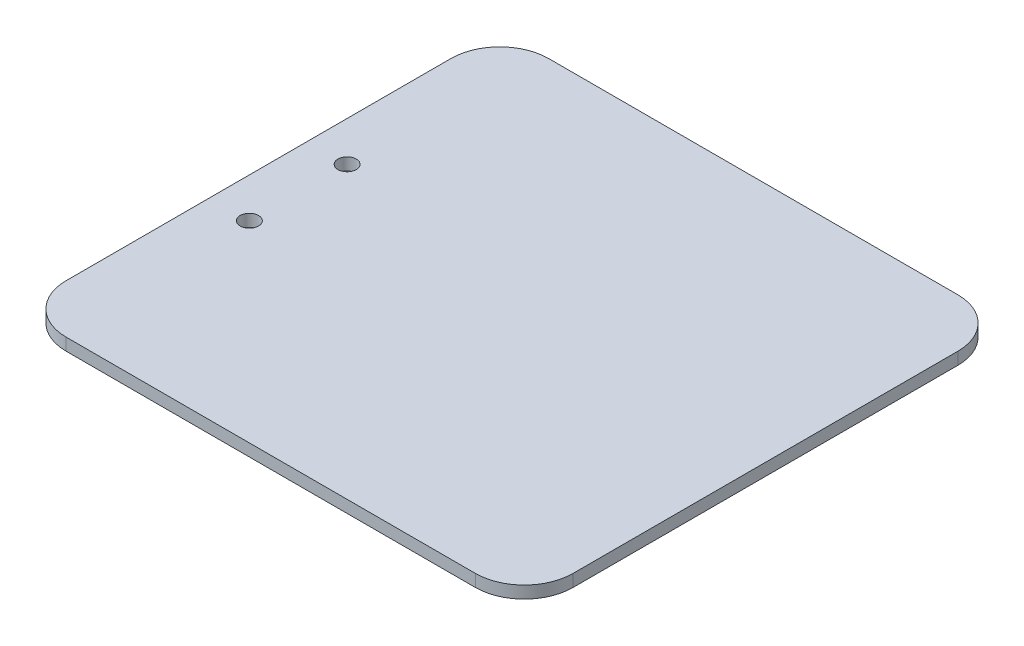
from build123d import *

# Parameters (mm, degrees)
SKETCH1_R           = 1.5
BOSS_EXTRUDE1_DEPTH = 2


with BuildPart() as part:
    # Sketch1 → Boss-Extrude1 (new body)
    with BuildSketch(Plane(origin=(0, 0, 0), x_dir=(1, 0, 0), z_dir=(0, 1, 0))):
        with BuildLine():
            Line((8, 0), (75, 0))
            ThreePointArc((75, 0), (80.656854249, 2.343145751), (83, 8))
            Line((83, 8), (83, 71))
            ThreePointArc((83, 71), (80.656854249, 76.656854249), (75, 79))
            Line((75, 79), (8, 79))
            ThreePointArc((8, 79), (2.343145751, 76.656854249), (0, 71))
            Line((0, 71), (0, 8))
            ThreePointArc((0, 8), (2.343145751, 2.343145751), (8, 0))
        make_face()
        with Locations(Location((6.5, 47.5, 0), (0, 0, 270))):
            Circle(SKETCH1_R, mode=Mode.SUBTRACT)
        with Locations(Location((6.5, 31.5, 0), (0, 0, 90))):
            Circle(SKETCH1_R, mode=Mode.SUBTRACT)
    extrude(amount=BOSS_EXTRUDE1_DEPTH)


solid = part.part
